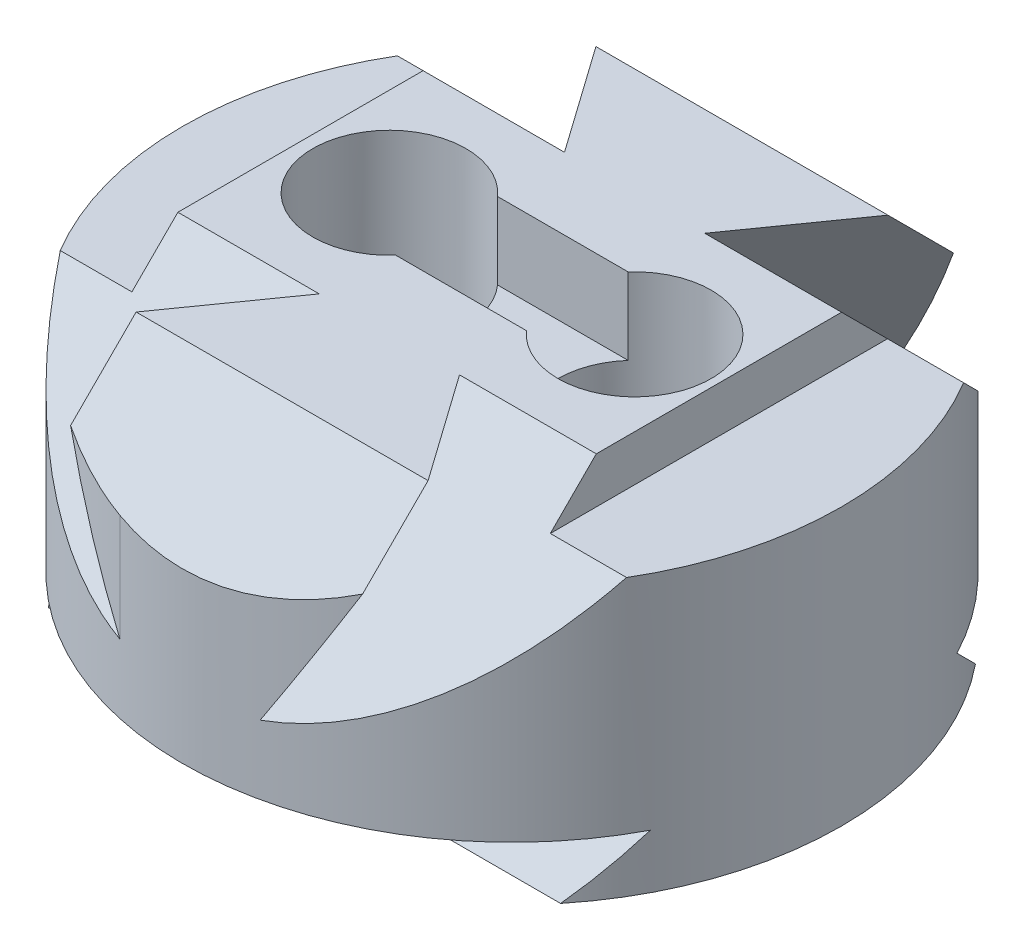
from build123d import *

# Parameters (mm, degrees)
SKETCH1_R                             = 21.5
BOSS_EXTRUDE1_DEPTH                   = 4
SKETCH2_R                             = 5.875
BOSS_EXTRUDE2_DEPTH                   = 65
BOSS_EXTRUDE3_REACH                   = 73.76
BOSS_EXTRUDE3_END_RADIUS              = 21.5
BOSS_EXTRUDE3_DIRECTION_2_REACH       = 73.76
BOSS_EXTRUDE3_DIRECTION_2_END_RADIUS  = 21.5
BOSS_EXTRUDE12_REACH                  = 71.147
BOSS_EXTRUDE12_END_RADIUS             = 21.5
BOSS_EXTRUDE13_REACH                  = 71.147
BOSS_EXTRUDE13_END_RADIUS             = 21.5
CUT_EXTRUDE3_DEPTH                    = 10
CUT_EXTRUDE3_DEPTH_BACK               = 2
SKETCH14_OUTSIDE_W                    = 63.394
SKETCH14_OUTSIDE_H                    = 63.394
SKETCH14_OUTSIDE_R                    = 5.875
SKETCH29_R                            = 7.508109265
CUT_EXTRUDE9_DEPTH                    = 51.5
SKETCH30_R                            = 5
CUT_EXTRUDE10_DEPTH                   = 9.8
CUT_EXTRUDE13_DEPTH                   = 38.426594822
CUT_EXTRUDE13_DEPTH_BACK              = 38.426594822
SKETCH31_W                            = 8
SKETCH31_H                            = 3
SKETCH31_W_2                          = 7.7
BOSS_EXTRUDE14_REACH                  = 35.268
BOSS_EXTRUDE14_END_RADIUS             = 21.5
BOSS_EXTRUDE14_DIRECTION_2_REACH      = 35.268
BOSS_EXTRUDE14_DIRECTION_2_END_RADIUS = 21.5
CUT_EXTRUDE14_START                   = -3
SKETCH36_R                            = 5
CUT_EXTRUDE14_DEPTH                   = 3
CUT_EXTRUDE15_REACH                   = 37.352
SKETCH38_R                            = 1.8923
SKETCH40_W                            = 8.521651504
SKETCH40_H                            = 6.638848076
CUT_EXTRUDE16_DEPTH                   = 5


with BuildPart() as part:
    # Sketch1 → Boss-Extrude1 (new body)
    with BuildSketch(Plane(origin=(0, 0, 0), x_dir=(1, 0, 0), z_dir=(0, 1, 0))):
        with Locations(Location((0, 0, 0), (0, 0, 270))):
            Circle(SKETCH1_R)
    extrude(amount=-BOSS_EXTRUDE1_DEPTH)

    # Sketch2 → Boss-Extrude2 (add)
    with BuildSketch(Plane(origin=(0, 0, 0), x_dir=(1, 0, 0), z_dir=(0, 1, 0))):
        with Locations(Location((0, 0, 0), (0, 0, 270))):
            Circle(SKETCH2_R)
    extrude(amount=BOSS_EXTRUDE2_DEPTH)

    # Boss-Extrude3: up to this cylinder (the profile starts inside it)
    boss_extrude3_end = Plane(origin=(0, 6.293939, 0), z_dir=(0, 1, 0)) * Cylinder(BOSS_EXTRUDE3_END_RADIUS, 191.52, mode=Mode.PRIVATE)
    # Sketch5 → Boss-Extrude3 (add, up to the surface)
    with BuildSketch(Plane(origin=(0, 0, 0), x_dir=(0, 0, -1), z_dir=(1, 0, 0)), mode=Mode.PRIVATE) as boss_extrude3_sk1:
        Polygon((21.5, 0), (0, 0), (-21.5, 0), (-6, 15.5), (6, 15.5), align=None)
    boss_extrude3_tool1 = extrude(boss_extrude3_sk1.sketch, amount=BOSS_EXTRUDE3_REACH, mode=Mode.PRIVATE) & boss_extrude3_end
    add(boss_extrude3_tool1.solids().sort_by_distance((0, 6.293939, 0))[0])

    # Boss-Extrude3 direction 2: up to this cylinder (the profile starts inside it)
    boss_extrude3_direction_2_end = Plane(origin=(0, 6.293939, 0), z_dir=(0, 1, 0)) * Cylinder(BOSS_EXTRUDE3_DIRECTION_2_END_RADIUS, 191.52, mode=Mode.PRIVATE)
    # Sketch5 → Boss-Extrude3 direction 2 (add, up to the surface)
    with BuildSketch(Plane(origin=(0, 0, 0), x_dir=(0, 0, -1), z_dir=(1, 0, 0)), mode=Mode.PRIVATE) as boss_extrude3_direction_2_sk1:
        Polygon((21.5, 0), (0, 0), (-21.5, 0), (-6, 15.5), (6, 15.5), align=None)
    boss_extrude3_direction_2_tool1 = extrude(boss_extrude3_direction_2_sk1.sketch, amount=-BOSS_EXTRUDE3_DIRECTION_2_REACH, mode=Mode.PRIVATE) & boss_extrude3_direction_2_end
    add(boss_extrude3_direction_2_tool1.solids().sort_by_distance((0, 6.293939, 0))[0])

    # Boss-Extrude12: up to this cylinder (the profile starts inside it)
    boss_extrude12_end = Plane(origin=(0, 17.454773, 0), z_dir=(0, 1, 0)) * Cylinder(BOSS_EXTRUDE12_END_RADIUS, 186.294, mode=Mode.PRIVATE)
    # Sketch6 → Boss-Extrude12 (add, up to the surface)
    with BuildSketch(Plane(origin=(0, 4.75, 4.75), x_dir=(-1, 0, 0), z_dir=(0, -0.7071067811865432, -0.7071067811865518)), mode=Mode.PRIVATE) as boss_extrude12_sk1:
        Polygon((0, 15.202795796), (4.575252532, 15.202795796), (9.525, 20.152543264), (0, 20.152543264), (-9.525, 20.152543264), (-4.575252532, 15.202795796), align=None)
    boss_extrude12_tool1 = extrude(boss_extrude12_sk1.sketch, amount=BOSS_EXTRUDE12_REACH, mode=Mode.PRIVATE) & boss_extrude12_end
    add(boss_extrude12_tool1.solids().sort_by_distance((0, 17.454773, -7.954773))[0])

    # Boss-Extrude13: up to this cylinder (the profile starts inside it)
    boss_extrude13_end = Plane(origin=(0, 17.454773, 0), z_dir=(0, 1, 0)) * Cylinder(BOSS_EXTRUDE13_END_RADIUS, 186.294, mode=Mode.PRIVATE)
    # Sketch10 → Boss-Extrude13 (add, up to the surface)
    with BuildSketch(Plane(origin=(0, 4.75, -4.75), x_dir=(-1, 0, 0), z_dir=(0, 0.7071067811865476, -0.7071067811865475)), mode=Mode.PRIVATE) as boss_extrude13_sk1:
        Polygon((0, 15.202795796), (-4.575252532, 15.202795796), (-9.525, 20.152543264), (0, 20.152543264), (9.525, 20.152543264), (4.575252532, 15.202795796), align=None)
    boss_extrude13_tool1 = extrude(boss_extrude13_sk1.sketch, amount=-BOSS_EXTRUDE13_REACH, mode=Mode.PRIVATE) & boss_extrude13_end
    add(boss_extrude13_tool1.solids().sort_by_distance((0, 17.454773, 7.954773))[0])

    # Sketch14 outside → Cut-Extrude3 (cut, two sides: drawn at the far end of the back side and taken through both)
    with BuildSketch(Plane(origin=(0, 15.5, 0), x_dir=(1, 0, 0), z_dir=(0, 1, 0)).offset(-CUT_EXTRUDE3_DEPTH_BACK)):
        Rectangle(SKETCH14_OUTSIDE_W, SKETCH14_OUTSIDE_H)
        with Locations(Location((0, 0, 0), (0, 0, 270))):
            Circle(SKETCH14_OUTSIDE_R, mode=Mode.SUBTRACT)
    extrude(amount=CUT_EXTRUDE3_DEPTH + CUT_EXTRUDE3_DEPTH_BACK, mode=Mode.SUBTRACT)

    # Sketch29 → Cut-Extrude9 (cut)
    with BuildSketch(Plane(origin=(0, 65, 0), x_dir=(1, 0, 0), z_dir=(0, 1, 0))):
        Circle(SKETCH29_R)
    extrude(amount=-CUT_EXTRUDE9_DEPTH, mode=Mode.SUBTRACT)

    # Sketch30 → Cut-Extrude10 (cut)
    with BuildSketch(Plane(origin=(0, 13.5, 0), x_dir=(1, 0, 0), z_dir=(0, 1, 0))):
        with Locations(Location((-8, 0, 0), (0, 0, 270))):
            Circle(SKETCH30_R)
        with Locations(Location((8, 0, 0), (0, 0, 270))):
            Circle(SKETCH30_R)
    extrude(amount=-CUT_EXTRUDE10_DEPTH, mode=Mode.SUBTRACT)

    # Sketch31 → Cut-Extrude13 (cut, two sides: drawn at the far end of the back side and taken through both)
    with BuildSketch(Plane.XY.offset(-6).offset(-CUT_EXTRUDE13_DEPTH_BACK)):
        with Locations((17.5, 12)):
            Rectangle(SKETCH31_W, SKETCH31_H)
        with Locations((-17.65, 12)):
            Rectangle(SKETCH31_W_2, SKETCH31_H)
    extrude(amount=CUT_EXTRUDE13_DEPTH + CUT_EXTRUDE13_DEPTH_BACK, mode=Mode.SUBTRACT)

    # Boss-Extrude14: up to this cylinder (the profile starts inside it)
    boss_extrude14_end = Plane(origin=(0, -5.856286, 0), z_dir=(0, 1, 0)) * Cylinder(BOSS_EXTRUDE14_END_RADIUS, 114.536, mode=Mode.PRIVATE)
    # Sketch34 → Boss-Extrude14 (add, up to the surface)
    with BuildSketch(Plane(origin=(0, 0, 0), x_dir=(0, 0, -1), z_dir=(1, 0, 0)), mode=Mode.PRIVATE) as boss_extrude14_sk1:
        Polygon((0, -4), (-10, -4), (-13.535533906, -7.535533906), (13.535533906, -7.535533906), (10, -4), align=None)
    boss_extrude14_tool1 = extrude(boss_extrude14_sk1.sketch, amount=BOSS_EXTRUDE14_REACH, mode=Mode.PRIVATE) & boss_extrude14_end
    add(boss_extrude14_tool1.solids().sort_by_distance((0, -5.856286, 0))[0])

    # Boss-Extrude14 direction 2: up to this cylinder (the profile starts inside it)
    boss_extrude14_direction_2_end = Plane(origin=(0, -5.856286, 0), z_dir=(0, 1, 0)) * Cylinder(BOSS_EXTRUDE14_DIRECTION_2_END_RADIUS, 114.536, mode=Mode.PRIVATE)
    # Sketch34 → Boss-Extrude14 direction 2 (add, up to the surface)
    with BuildSketch(Plane(origin=(0, 0, 0), x_dir=(0, 0, -1), z_dir=(1, 0, 0)), mode=Mode.PRIVATE) as boss_extrude14_direction_2_sk1:
        Polygon((0, -4), (-10, -4), (-13.535533906, -7.535533906), (13.535533906, -7.535533906), (10, -4), align=None)
    boss_extrude14_direction_2_tool1 = extrude(boss_extrude14_direction_2_sk1.sketch, amount=-BOSS_EXTRUDE14_DIRECTION_2_REACH, mode=Mode.PRIVATE) & boss_extrude14_direction_2_end
    add(boss_extrude14_direction_2_tool1.solids().sort_by_distance((0, -5.856286, 0))[0])

    # Sketch36 → Cut-Extrude14 (cut)
    with BuildSketch(Plane.XZ.offset(7.535533906).offset(CUT_EXTRUDE14_START)):
        with Locations(Location((-8, 0, 0), (0, 0, 90))):
            Circle(SKETCH36_R)
        with Locations(Location((8, 0, 0), (0, 0, 90))):
            Circle(SKETCH36_R)
    extrude(amount=CUT_EXTRUDE14_DEPTH, mode=Mode.SUBTRACT)

    # Sketch38 → Cut-Extrude15 (cut, up to next)
    with BuildSketch(Plane.XZ.offset(4.535533906), mode=Mode.PRIVATE) as cut_extrude15_sk1:
        with Locations(Location((-8, 0, 0), (0, 0, 270))):
            Circle(SKETCH38_R)
    cut_extrude15_tool1 = extrude(cut_extrude15_sk1.sketch, amount=-CUT_EXTRUDE15_REACH, mode=Mode.PRIVATE) & part.part
    # Sketch38 → Cut-Extrude15 (cut, up to next)
    with BuildSketch(Plane.XZ.offset(4.535533906), mode=Mode.PRIVATE) as cut_extrude15_sk2:
        with Locations(Location((8, 0, 0), (0, 0, 270))):
            Circle(SKETCH38_R)
    cut_extrude15_tool2 = extrude(cut_extrude15_sk2.sketch, amount=-CUT_EXTRUDE15_REACH, mode=Mode.PRIVATE) & part.part
    add(cut_extrude15_tool1.solids().sort_by_distance((-8, -4.535534, 0))[0], mode=Mode.SUBTRACT)
    add(cut_extrude15_tool2.solids().sort_by_distance((8, -4.535534, 0))[0], mode=Mode.SUBTRACT)

    # Sketch40 → Cut-Extrude16 (cut)
    with BuildSketch(Plane(origin=(0, 13.5, 0), x_dir=(1, 0, 0), z_dir=(0, 1, 0))):
        Rectangle(SKETCH40_W, SKETCH40_H)
    extrude(amount=-CUT_EXTRUDE16_DEPTH, mode=Mode.SUBTRACT)


solid = part.part
